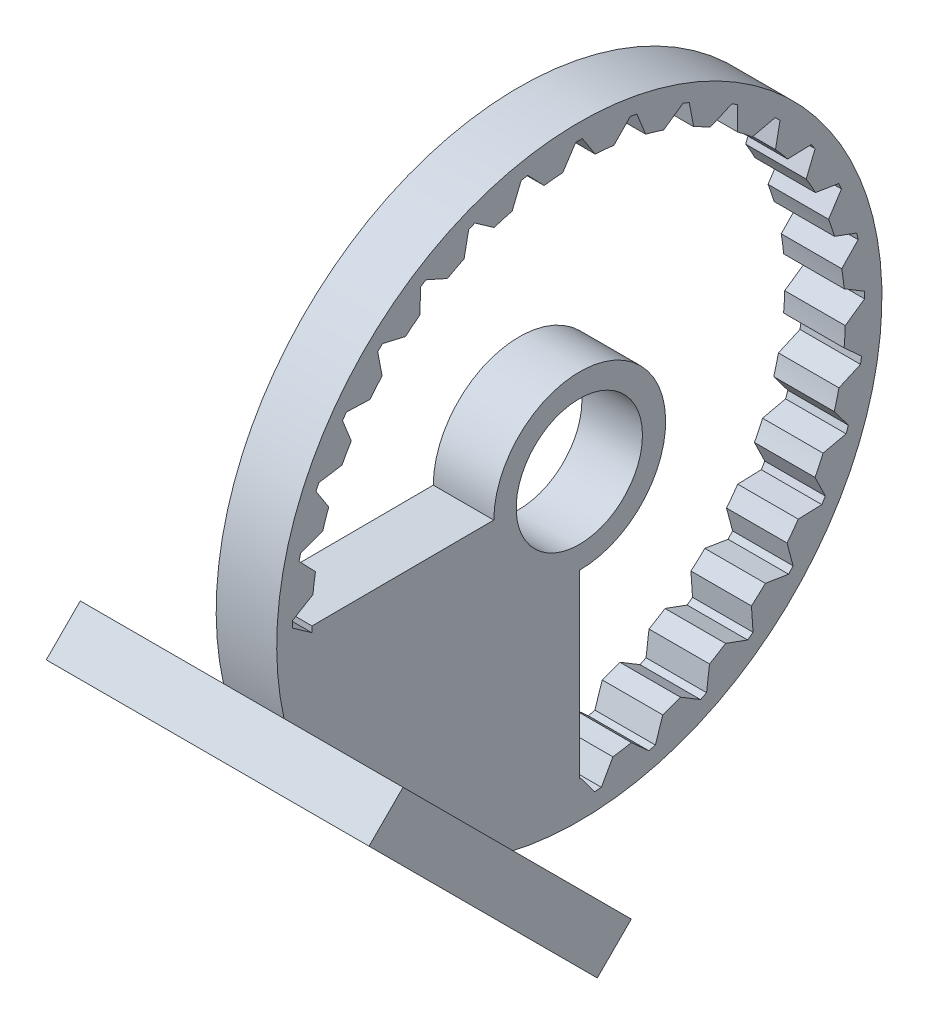
from build123d import *

# Parameters (mm, degrees)
SKETCH1_R           = 50
BOSS_EXTRUDE2_DEPTH = 10
SKETCH7_R           = 10.430903113
CUT_EXTRUDE5_DEPTH  = 10
CUT_EXTRUDE8_DEPTH  = 72.414284285
CUT_EXTRUDE9_DEPTH  = 72.414284285
CIRPATTERN3_COUNT   = 9
CIRPATTERN3_ANGLE   = 88
CIRPATTERN4_COUNT   = 17
CIRPATTERN4_ANGLE   = 176
SCALE3_SCALE        = 0.75
BOSS_EXTRUDE3_DEPTH = 15
BOSS_EXTRUDE6_DEPTH = 25
SKETCH19_R          = 1.5
CUT_EXTRUDE10_DEPTH = 2.5


with BuildPart() as part:
    # Sketch1 → Boss-Extrude2 (new body)
    with BuildSketch(Plane.YZ):
        with Locations(Location((0, 0, 0), (0, 0, 270))):
            Circle(SKETCH1_R)
    extrude(amount=BOSS_EXTRUDE2_DEPTH)

    # Sketch7 → Cut-Extrude5 (cut)
    with BuildSketch(Plane.YZ.offset(10)):
        with Locations(Location((0, 0, 0), (0, 0, 270))):
            Circle(SKETCH7_R)
    extrude(amount=-CUT_EXTRUDE5_DEPTH, mode=Mode.SUBTRACT)

    # Sketch10 → Cut-Extrude8 (cut, through all)
    with BuildSketch(Plane.YZ.offset(10)):
        with BuildLine():
            Line((-43.954399928, 0), (-14.132830655, 0))
            ThreePointArc((-14.132830655, 0), (10.058249892, -10.149932648), (0.129658997, 14.132830655))
            Line((0.129658997, 14.132830655), (0, 44.213717922))
            ThreePointArc((0, 44.213717922), (31.393478761, -30.950795255), (-43.954399928, 0))
        make_face()
    extrude(amount=-CUT_EXTRUDE8_DEPTH, mode=Mode.SUBTRACT)

    # Sketch12 → Cut-Extrude9 (cut, through all)
    with BuildSketch(Plane.YZ.offset(10)):
        Polygon((47.400317311, 0), (47.400317311, 0.608013975), (44.136400392, 2.742660057), (44.128376975, -2.615132262), (47.400317311, -0.500577082), align=None)
    cut_extrude9 = extrude(amount=-CUT_EXTRUDE9_DEPTH, mode=Mode.SUBTRACT)

    # CirPattern3: Cut-Extrude9 ×9 about axis
    cirpattern3_axis = Axis((0, 0.129658997, 0.129658997), (1, 0, 0))
    for i in range(1, CIRPATTERN3_COUNT):
        add(cut_extrude9.rotate(cirpattern3_axis, i * CIRPATTERN3_ANGLE / (CIRPATTERN3_COUNT - 1)), mode=Mode.SUBTRACT)

    # CirPattern4: Cut-Extrude9 ×17 about axis
    cirpattern4_axis = Axis((0, 0.129658997, 0.129658997), (-1, 0, 0))
    for i in range(1, CIRPATTERN4_COUNT):
        add(cut_extrude9.rotate(cirpattern4_axis, i * CIRPATTERN4_ANGLE / (CIRPATTERN4_COUNT - 1)), mode=Mode.SUBTRACT)


with BuildPart() as part_1:
    # Scale3: scaled about (0, 0, 0)
    add(part.part.scale(SCALE3_SCALE))

    # Sketch15 → Boss-Extrude3 (add)
    with BuildSketch(Plane.YZ.offset(7.5)):
        Polygon((-12.172757091, 41.059305133), (-7.956454872, 36.843002914), (-36.24072612, 8.558731667), (-40.457028339, 12.775033886), align=None)
    extrude(amount=BOSS_EXTRUDE3_DEPTH)

    # Sketch20 → Boss-Extrude6 (add)
    with BuildSketch(Plane(origin=(7.5, 0, 0), x_dir=(0, -1, 0), z_dir=(-1, 0, 0))):
        Polygon((7.956454872, 36.843002914), (12.172757091, 41.059305133), (40.457028339, 12.775033886), (36.24072612, 8.558731667), align=None)
    extrude(amount=BOSS_EXTRUDE6_DEPTH)

    # Sketch19 → Cut-Extrude10 (cut)
    with BuildSketch(Plane(origin=(0, -26.616031112, 26.616031112), x_dir=(1, 0, 0), z_dir=(0, -0.7071067811865476, 0.7071067811865475))):
        with Locations(Location((-14.5, -16.574125994, 0), (0, 0, 270))):
            Circle(SKETCH19_R)
        with Locations(Location((-14.5, 17.425874006, 0), (0, 0, 270))):
            Circle(SKETCH19_R)
        with Locations(Location((-11.5, 14.425874006, 0), (0, 0, 270))):
            Circle(SKETCH19_R)
        with Locations(Location((-11.5, -13.574125994, 0), (0, 0, 270))):
            Circle(SKETCH19_R)
        with Locations(Location((19.5, 17.425874006, 0), (0, 0, 270))):
            Circle(SKETCH19_R)
        with Locations(Location((16.5, 14.425874006, 0), (0, 0, 270))):
            Circle(SKETCH19_R)
        with Locations(Location((16.5, -13.574125994, 0), (0, 0, 270))):
            Circle(SKETCH19_R)
        with Locations(Location((19.5, -16.574125994, 0), (0, 0, 270))):
            Circle(SKETCH19_R)
    extrude(amount=-CUT_EXTRUDE10_DEPTH, mode=Mode.SUBTRACT)


solid = part_1.part
